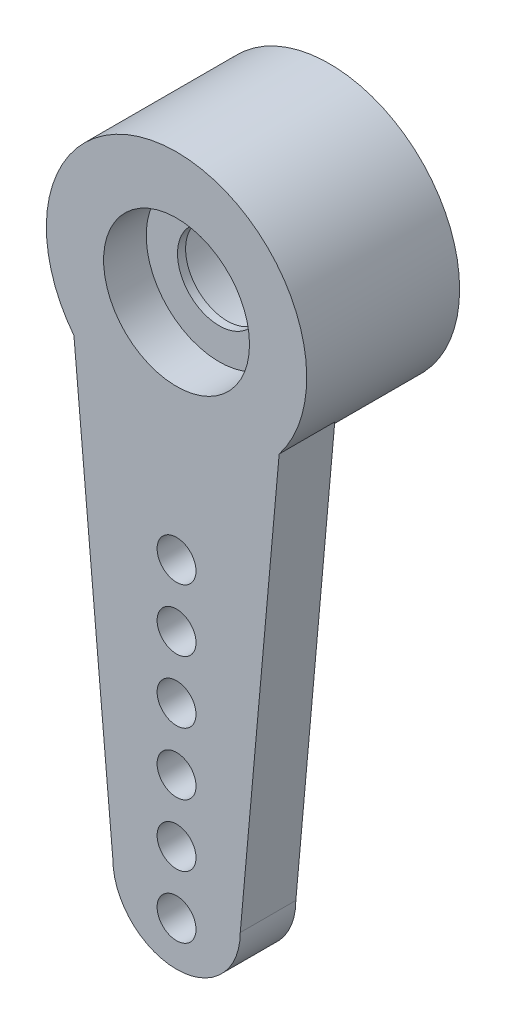
from build123d import *

# Parameters (mm, degrees)
SKETCH1_R           = 3.5687
SKETCH1_R_2         = 2
BOSS_EXTRUDE1_DEPTH = 4.191
SKETCH5_R           = 2
SKETCH5_R_2         = 1.143
BOSS_EXTRUDE2_DEPTH = 0.2226
BOSS_EXTRUDE3_START = -1.524
SKETCH6_R           = 0.5334
BOSS_EXTRUDE3_DEPTH = 1.524


with BuildPart() as part:
    # Sketch1 → Boss-Extrude1 (new body)
    with BuildSketch(Plane.XY.offset(-7.032965862)):
        with Locations((-5.5, 0)):
            Circle(SKETCH1_R)
        with Locations((-5.5, 0)):
            Circle(SKETCH1_R_2, mode=Mode.SUBTRACT)
    extrude(amount=BOSS_EXTRUDE1_DEPTH)

    # Sketch5 → Boss-Extrude2 (add)
    with BuildSketch(Plane.XY.offset(-4.232965862)):
        with Locations((-5.5, 0)):
            Circle(SKETCH5_R)
        with Locations((-5.5, 0)):
            Circle(SKETCH5_R_2, mode=Mode.SUBTRACT)
    extrude(amount=BOSS_EXTRUDE2_DEPTH)

    # Sketch6 → Boss-Extrude3 (add)
    with BuildSketch(Plane.XY.offset(-2.841965862).offset(BOSS_EXTRUDE3_START)):
        with BuildLine():
            Line((-3.75375, -14.09065), (-2.68695, -2.195989387))
            ThreePointArc((-2.68695, -2.195989387), (-5.5, -3.5687), (-8.31305, -2.195989387))
            Line((-8.31305, -2.195989387), (-7.24625, -14.09065))
            ThreePointArc((-7.24625, -14.09065), (-5.5, -15.8369), (-3.75375, -14.09065))
        make_face()
        with Locations((-5.5, -12.92225)):
            Circle(SKETCH6_R, mode=Mode.SUBTRACT)
        with Locations((-5.5, -14.62405)):
            Circle(SKETCH6_R, mode=Mode.SUBTRACT)
        with Locations((-5.5, -11.22045)):
            Circle(SKETCH6_R, mode=Mode.SUBTRACT)
        with Locations((-5.5, -9.51865)):
            Circle(SKETCH6_R, mode=Mode.SUBTRACT)
        with Locations((-5.5, -7.81685)):
            Circle(SKETCH6_R, mode=Mode.SUBTRACT)
        with Locations((-5.5, -6.11505)):
            Circle(SKETCH6_R, mode=Mode.SUBTRACT)
    extrude(amount=BOSS_EXTRUDE3_DEPTH)


solid = part.part
